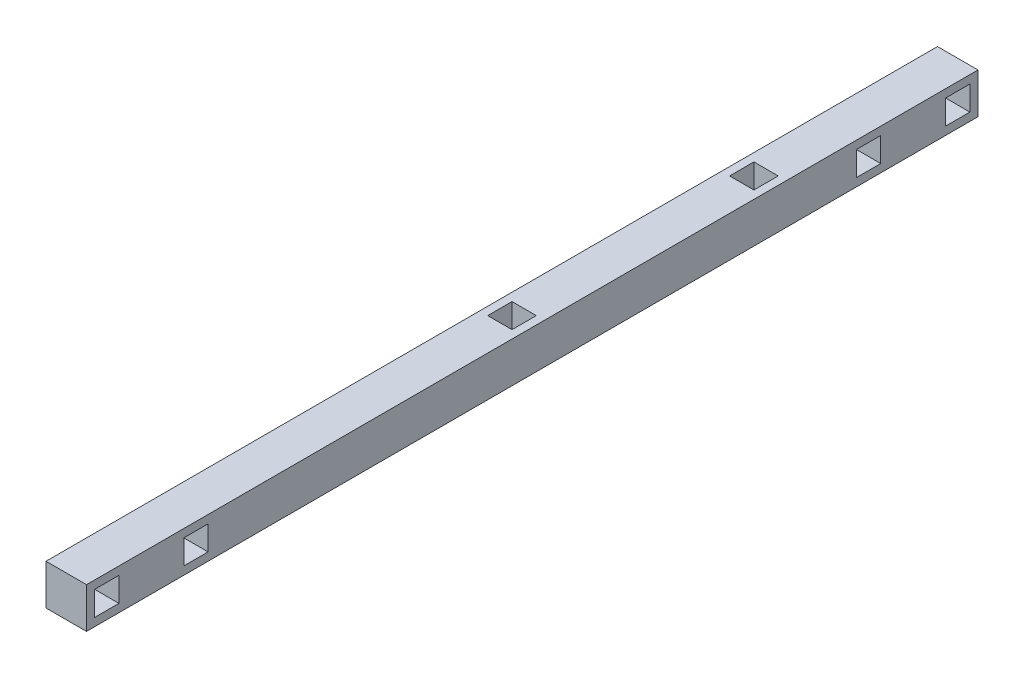
from build123d import *

# Parameters (mm, degrees)
SKETCH1_W           = 5
SKETCH1_H           = 5
BOSS_EXTRUDE1_DEPTH = 110
SKETCH2_W           = 3
SKETCH2_H           = 3
CUT_EXTRUDE1_DEPTH  = 9
SKETCH3_W           = 3
SKETCH3_H           = 3
CUT_EXTRUDE2_DEPTH  = 9


with BuildPart() as part:
    # Sketch1 → Boss-Extrude1 (new body)
    with BuildSketch(Plane.XY):
        with Locations((2.5, 2.5)):
            Rectangle(SKETCH1_W, SKETCH1_H)
    extrude(amount=BOSS_EXTRUDE1_DEPTH)

    # Sketch2 → Cut-Extrude1 (cut)
    with BuildSketch(Plane.ZY):
        with Locations((2.5, 2.5)):
            Rectangle(SKETCH2_W, SKETCH2_H)
        with Locations((107.5, 2.5)):
            Rectangle(SKETCH2_W, SKETCH2_H)
        with Locations((13.5, 2.5)):
            Rectangle(SKETCH2_W, SKETCH2_H)
        with Locations((96.5, 2.5)):
            Rectangle(SKETCH2_W, SKETCH2_H)
    extrude(amount=-CUT_EXTRUDE1_DEPTH, mode=Mode.SUBTRACT)

    # Sketch3 → Cut-Extrude2 (cut)
    with BuildSketch(Plane(origin=(0, 5, 0), x_dir=(1, 0, 0), z_dir=(0, 1, 0))):
        with Locations((2.5, -25.15)):
            Rectangle(SKETCH3_W, SKETCH3_H)
        with Locations((2.5, -55)):
            Rectangle(SKETCH3_W, SKETCH3_H)
    extrude(amount=-CUT_EXTRUDE2_DEPTH, mode=Mode.SUBTRACT)


solid = part.part
